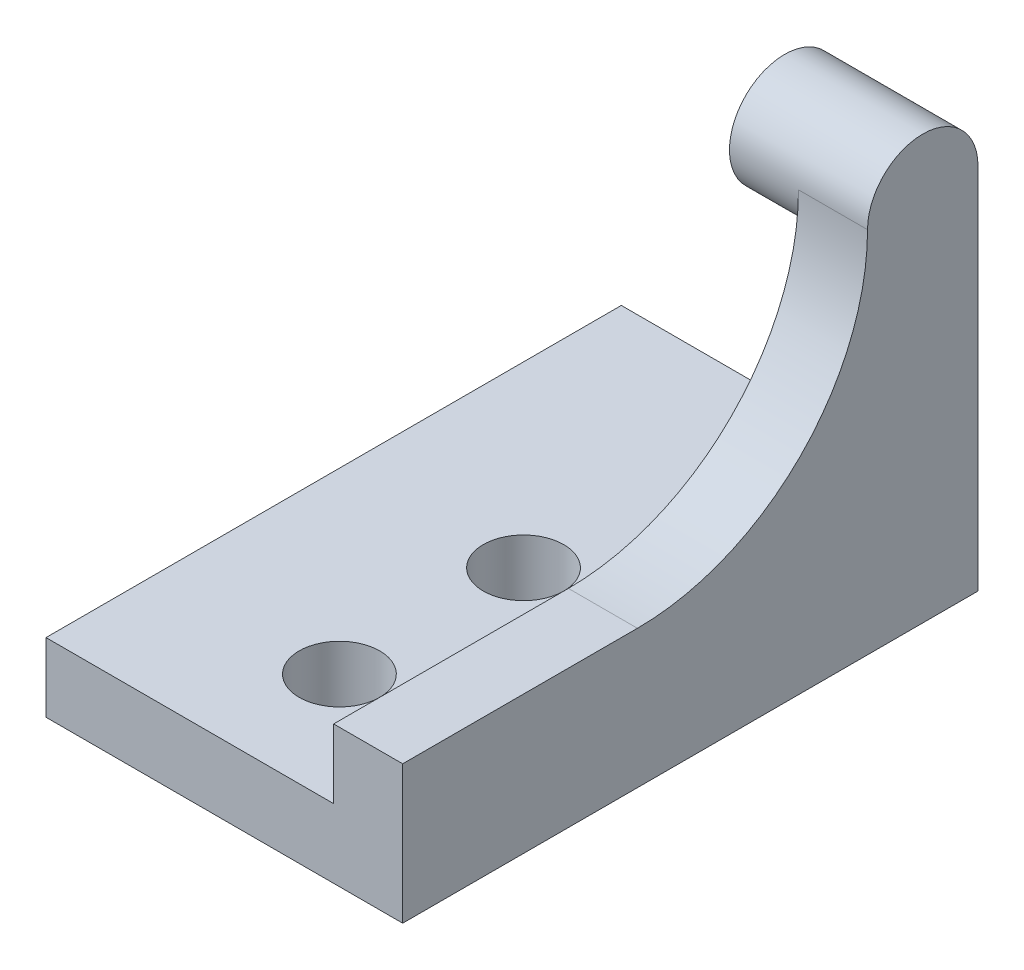
from build123d import *

# Parameters (mm, degrees)
ESQUISSE1_R        = 2.4
BOSS_EXTRU_1_DEPTH = 3
BOSS_EXTRU_2_DEPTH = 3
ESQUISSE3_W        = 15.5
ESQUISSE3_H        = 25
ESQUISSE3_R        = 1.75
BOSS_EXTRU_3_DEPTH = 3


with BuildPart() as part:
    # Esquisse1 → Boss.-Extru.1 (new body)
    with BuildSketch(Plane(origin=(0, 0, 0), x_dir=(0, 0, -1), z_dir=(1, 0, 0))):
        Circle(ESQUISSE1_R)
    extrude(amount=BOSS_EXTRU_1_DEPTH)

    # Esquisse2 → Boss.-Extru.2 (add)
    with BuildSketch(Plane(origin=(3, 0, 0), x_dir=(0, 0, -1), z_dir=(1, 0, 0))):
        with BuildLine():
            Line((-2.4, -13), (-22.6, -13))
            Line((-22.6, -13), (-22.6, -10))
            Line((-22.6, -10), (-12.4, -10))
            ThreePointArc((-12.4, -10), (-5.328932188, -7.071067812), (-2.4, 0))
            ThreePointArc((-2.4, 0), (0, 2.4), (2.4, 0))
            Line((2.4, 0), (2.4, -13))
            Line((2.4, -13), (-2.4, -13))
        make_face()
    extrude(amount=BOSS_EXTRU_2_DEPTH)

    # Esquisse3 → Boss.-Extru.3 (add)
    with BuildSketch(Plane.XZ.offset(13)):
        with Locations((-1.75, 10.1)):
            Rectangle(ESQUISSE3_W, ESQUISSE3_H)
        with Locations(Location((-1.75, 9.6, 0), (0, 0, 270))):
            Circle(ESQUISSE3_R, mode=Mode.SUBTRACT)
        with Locations(Location((-1.75, 17.6, 0), (0, 0, 270))):
            Circle(ESQUISSE3_R, mode=Mode.SUBTRACT)
    extrude(amount=BOSS_EXTRU_3_DEPTH)


solid = part.part
